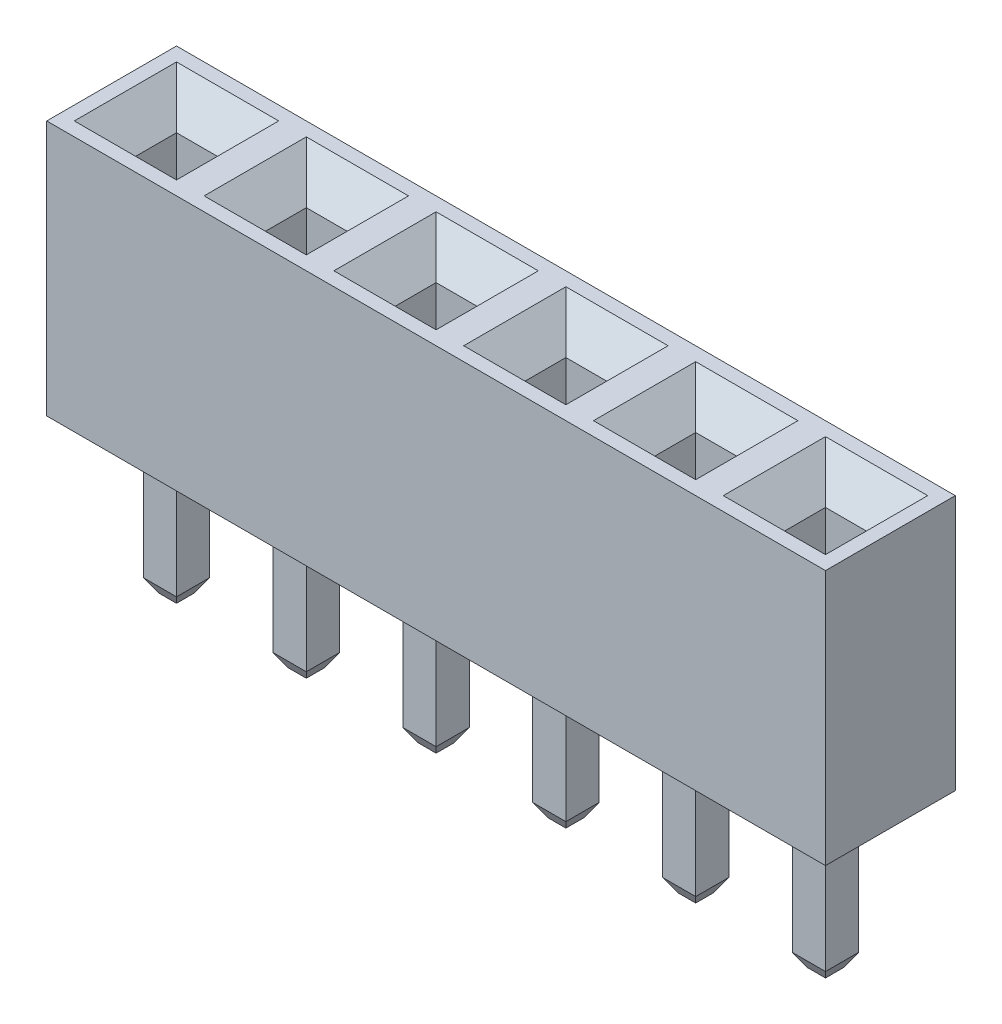
from build123d import *

# Parameters (mm, degrees)
SKETCH1_W                   = 2.54
SKETCH1_H                   = 2.54
BOSS_EXTRUDE1_DEPTH         = 5
SKETCH2_W                   = 0.65
SKETCH2_H                   = 0.65
BOSS_EXTRUDE2_DEPTH         = 3
CHAMFER1_SIZE               = 0.15
CHAMFER1_SIZE2              = 0.259807621
SKETCH3_W                   = 0.8
SKETCH3_H                   = 0.8
CUT_EXTRUDE1_DEPTH          = 3
CHAMFER2_SIZE               = 0.6
LPATTERN1_COUNT             = 6
LPATTERN1_PITCH             = 2.54
CHAMFER1_OF_LPATTERN1_SIZE2 = 0.15
CHAMFER1_OF_LPATTERN1_SIZE  = 0.259807621
CHAMFER2_OF_LPATTERN1_SIZE  = 0.6


with BuildPart() as part:
    # Sketch1 → Boss-Extrude1 (new body)
    with BuildSketch(Plane(origin=(0, 0, 0), x_dir=(1, 0, 0), z_dir=(0, 1, 0))):
        Rectangle(SKETCH1_W, SKETCH1_H)
    boss_extrude1 = extrude(amount=BOSS_EXTRUDE1_DEPTH)

    # Sketch2 → Boss-Extrude2 (add)
    with BuildSketch(Plane.XZ):
        Rectangle(SKETCH2_W, SKETCH2_H)
    boss_extrude2 = extrude(amount=BOSS_EXTRUDE2_DEPTH)

    # Chamfer1
    chamfer1_edges = [part.edges().sort_by_distance(p)[0] for p in [
        (0.325, -3, 0),
        (0, -3, 0.325),
        (-0.325, -3, 0),
        (0, -3, -0.325),
    ]]
    chamfer1_side = [part.faces().sort_by_distance(p)[0] for p in [
        (0, -3, 0),
    ]]
    chamfer(chamfer1_edges, length=CHAMFER1_SIZE, length2=CHAMFER1_SIZE2, reference=chamfer1_side[0])

    # Sketch3 → Cut-Extrude1 (cut)
    with BuildSketch(Plane(origin=(0, 5, 0), x_dir=(1, 0, 0), z_dir=(0, 1, 0))):
        Rectangle(SKETCH3_W, SKETCH3_H)
    cut_extrude1 = extrude(amount=-CUT_EXTRUDE1_DEPTH, mode=Mode.SUBTRACT)

    # Chamfer2
    chamfer2_edges = [part.edges().sort_by_distance(p)[0] for p in [
        (0.4, 5, 0),
        (0, 5, -0.4),
        (-0.4, 5, 0),
        (0, 5, 0.4),
    ]]
    chamfer(chamfer2_edges, length=CHAMFER2_SIZE)

    # LPattern1: Boss-Extrude1, Boss-Extrude2, Cut-Extrude1 ×6
    with Locations(*[(i * LPATTERN1_PITCH, 0, 0) for i in range(1, LPATTERN1_COUNT)]):
        add(boss_extrude1)
        add(boss_extrude2)
        add(cut_extrude1, mode=Mode.SUBTRACT)

    # Chamfer1 of LPattern1
    chamfer1_of_lpattern1_edges = [part.edges().sort_by_distance(p)[0] for p in [
        (2.865, -3, 0),
        (2.54, -3, 0.325),
        (2.215, -3, 0),
        (2.54, -3, -0.325),
        (5.405, -3, 0),
        (5.08, -3, 0.325),
        (4.755, -3, 0),
        (5.08, -3, -0.325),
        (7.945, -3, 0),
        (7.62, -3, 0.325),
        (7.295, -3, 0),
        (7.62, -3, -0.325),
        (10.485, -3, 0),
        (10.16, -3, 0.325),
        (9.835, -3, 0),
        (10.16, -3, -0.325),
        (13.025, -3, 0),
        (12.7, -3, 0.325),
        (12.375, -3, 0),
        (12.7, -3, -0.325),
    ]]
    chamfer(chamfer1_of_lpattern1_edges, length=CHAMFER1_OF_LPATTERN1_SIZE, length2=CHAMFER1_OF_LPATTERN1_SIZE2)

    # Chamfer2 of LPattern1
    chamfer2_of_lpattern1_edges = [part.edges().sort_by_distance(p)[0] for p in [
        (2.94, 5, 0),
        (2.54, 5, -0.4),
        (2.14, 5, 0),
        (2.54, 5, 0.4),
        (5.48, 5, 0),
        (5.08, 5, -0.4),
        (4.68, 5, 0),
        (5.08, 5, 0.4),
        (8.02, 5, 0),
        (7.62, 5, -0.4),
        (7.22, 5, 0),
        (7.62, 5, 0.4),
        (10.56, 5, 0),
        (10.16, 5, -0.4),
        (9.76, 5, 0),
        (10.16, 5, 0.4),
        (13.1, 5, 0),
        (12.7, 5, -0.4),
        (12.3, 5, 0),
        (12.7, 5, 0.4),
    ]]
    chamfer(chamfer2_of_lpattern1_edges, length=CHAMFER2_OF_LPATTERN1_SIZE)


solid = part.part
